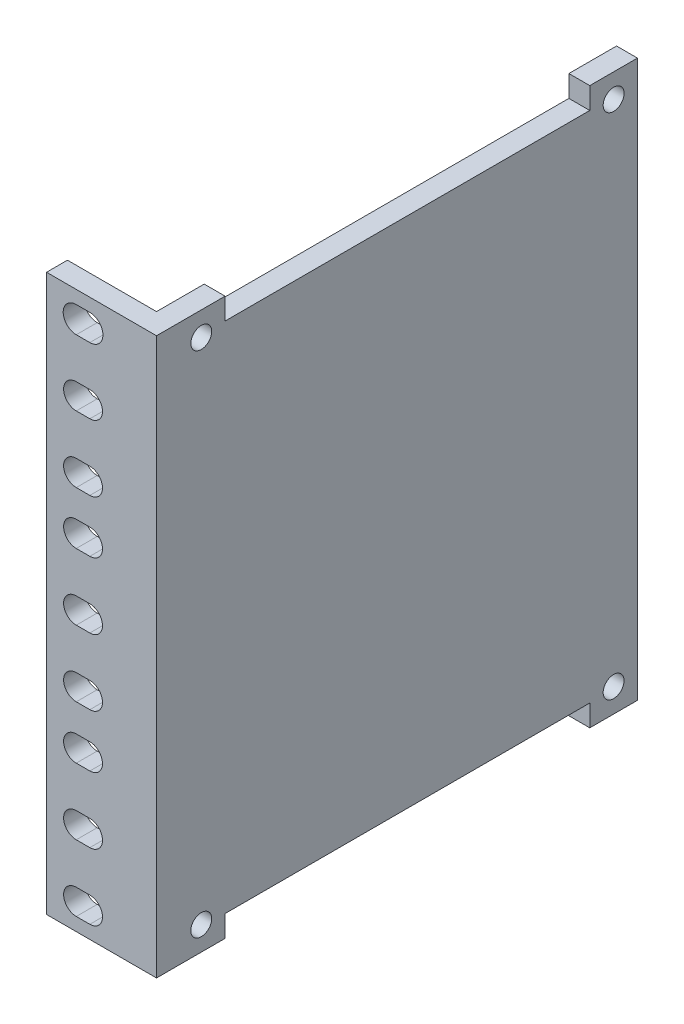
from build123d import *

# Parameters (mm, degrees)
SKETCH1_W           = 26.3
SKETCH1_H           = 133
BOSS_EXTRUDE1_DEPTH = 5
SKETCH2_R           = 2.5
BOSS_EXTRUDE2_DEPTH = 5
BOSS_EXTRUDE3_START = -15
BOSS_EXTRUDE3_DEPTH = 103


with BuildPart() as part:
    # Sketch1 → Boss-Extrude1 (new body)
    with BuildSketch(Plane.XY):
        with Locations((-34.698380987, 507.595307356)):
            Rectangle(SKETCH1_W, SKETCH1_H)
        with BuildLine():
            ThreePointArc((-40.742130987, 444.245307356), (-43.767130987, 447.270307356), (-40.742130987, 450.295307356))
            Line((-40.742130987, 450.295307356), (-37.492130987, 450.295307356))
            ThreePointArc((-37.492130987, 450.295307356), (-34.467130987, 447.270307356), (-37.492130987, 444.245307356))
            Line((-37.492130987, 444.245307356), (-40.742130987, 444.245307356))
        make_face(mode=Mode.SUBTRACT)
        with BuildLine():
            ThreePointArc((-40.742130987, 460.120307356), (-43.767130987, 463.145307356), (-40.742130987, 466.170307356))
            Line((-40.742130987, 466.170307356), (-37.492130987, 466.170307356))
            ThreePointArc((-37.492130987, 466.170307356), (-34.467130987, 463.145307356), (-37.492130987, 460.120307356))
            Line((-37.492130987, 460.120307356), (-40.742130987, 460.120307356))
        make_face(mode=Mode.SUBTRACT)
        with BuildLine():
            ThreePointArc((-40.742130987, 475.995307356), (-43.767130987, 479.020307356), (-40.742130987, 482.045307356))
            Line((-40.742130987, 482.045307356), (-37.492130987, 482.045307356))
            ThreePointArc((-37.492130987, 482.045307356), (-34.467130987, 479.020307356), (-37.492130987, 475.995307356))
            Line((-37.492130987, 475.995307356), (-40.742130987, 475.995307356))
        make_face(mode=Mode.SUBTRACT)
        with BuildLine():
            ThreePointArc((-40.742130987, 488.695307356), (-43.767130987, 491.720307356), (-40.742130987, 494.745307356))
            Line((-40.742130987, 494.745307356), (-37.492130987, 494.745307356))
            ThreePointArc((-37.492130987, 494.745307356), (-34.467130987, 491.720307356), (-37.492130987, 488.695307356))
            Line((-37.492130987, 488.695307356), (-40.742130987, 488.695307356))
        make_face(mode=Mode.SUBTRACT)
        with BuildLine():
            ThreePointArc((-40.742130987, 504.570307356), (-43.767130987, 507.595307356), (-40.742130987, 510.620307356))
            Line((-40.742130987, 510.620307356), (-37.492130987, 510.620307356))
            ThreePointArc((-37.492130987, 510.620307356), (-34.467130987, 507.595307356), (-37.492130987, 504.570307356))
            Line((-37.492130987, 504.570307356), (-40.742130987, 504.570307356))
        make_face(mode=Mode.SUBTRACT)
        with BuildLine():
            ThreePointArc((-40.742130987, 520.445307356), (-43.767130987, 523.470307356), (-40.742130987, 526.495307356))
            Line((-40.742130987, 526.495307356), (-37.492130987, 526.495307356))
            ThreePointArc((-37.492130987, 526.495307356), (-34.467130987, 523.470307356), (-37.492130987, 520.445307356))
            Line((-37.492130987, 520.445307356), (-40.742130987, 520.445307356))
        make_face(mode=Mode.SUBTRACT)
        with BuildLine():
            ThreePointArc((-40.742130987, 533.057807356), (-43.767130987, 536.082807356), (-40.742130987, 539.107807356))
            Line((-40.742130987, 539.107807356), (-37.492130987, 539.107807356))
            ThreePointArc((-37.492130987, 539.107807356), (-34.467130987, 536.082807356), (-37.492130987, 533.057807356))
            Line((-37.492130987, 533.057807356), (-40.742130987, 533.057807356))
        make_face(mode=Mode.SUBTRACT)
        with BuildLine():
            ThreePointArc((-40.742130987, 548.932807356), (-43.767130987, 551.957807356), (-40.742130987, 554.982807356))
            Line((-40.742130987, 554.982807356), (-37.492130987, 554.982807356))
            ThreePointArc((-37.492130987, 554.982807356), (-34.467130987, 551.957807356), (-37.492130987, 548.932807356))
            Line((-37.492130987, 548.932807356), (-40.742130987, 548.932807356))
        make_face(mode=Mode.SUBTRACT)
        with BuildLine():
            ThreePointArc((-40.742130987, 564.707807356), (-43.867130987, 567.832807356), (-40.742130987, 570.957807356))
            Line((-40.742130987, 570.957807356), (-37.492130987, 570.957807356))
            ThreePointArc((-37.492130987, 570.957807356), (-34.367130987, 567.832807356), (-37.492130987, 564.707807356))
            Line((-37.492130987, 564.707807356), (-40.742130987, 564.707807356))
        make_face(mode=Mode.SUBTRACT)
    extrude(amount=BOSS_EXTRUDE1_DEPTH)



with BuildPart() as body_2:
    # Sketch2 → Boss-Extrude2 (new body)
    with BuildSketch(Plane.ZY.offset(21.548380987)):
        Polygon((0, 558.595307356), (0, 456.595307356), (0, 441.095307356), (-11.4, 441.095307356), (-11.4, 446.245307356), (-98.6, 446.245307356), (-98.6, 441.095307356), (-110, 441.095307356), (-110, 574.095307356), (-98.6, 574.095307356), (-98.6, 568.945307356), (-11.4, 568.945307356), (-11.4, 574.095307356), (0, 574.095307356), align=None)
        with Locations(Location((-5.7, 568.395307356, 0), (0, 0, 270))):
            Circle(SKETCH2_R, mode=Mode.SUBTRACT)
        with Locations(Location((-104.3, 568.395307356, 0), (0, 0, 270))):
            Circle(SKETCH2_R, mode=Mode.SUBTRACT)
        with Locations(Location((-104.3, 446.795307356, 0), (0, 0, 270))):
            Circle(SKETCH2_R, mode=Mode.SUBTRACT)
        with Locations(Location((-5.7, 446.795307356, 0), (0, 0, 270))):
            Circle(SKETCH2_R, mode=Mode.SUBTRACT)
    extrude(amount=BOSS_EXTRUDE2_DEPTH)


with BuildPart() as part_1:
    add(part.part)

    add(body_2.part)  # Boss-Extrude3 merges body 2
    # Sketch4 → Boss-Extrude3 (add)
    with BuildSketch(Plane(origin=(0, 574.095307356, 0), x_dir=(1, 0, 0), z_dir=(0, 1, 0)).offset(BOSS_EXTRUDE3_START)):
        Polygon((-26.548380987, 0), (-29.548380987, 0), (-26.548380987, 10), align=None)
    extrude(amount=-BOSS_EXTRUDE3_DEPTH)


solid = part_1.part
